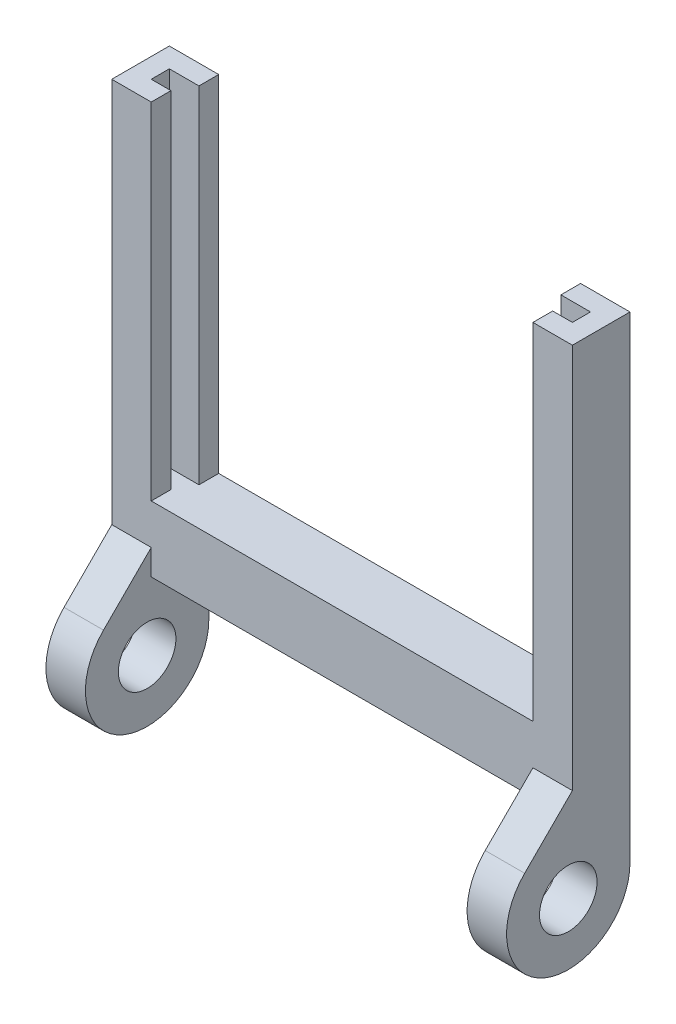
from build123d import *

# Parameters (mm, degrees)
SCHIZZO1_W                   = 28
SCHIZZO1_H                   = 25
ESTRUSIONE_ESTRUSIONE1_DEPTH = 1.2
SCHIZZO4_W                   = 22
SCHIZZO4_H                   = 21
TAGLIO_ESTRUSIONE1_DEPTH     = 19.806647761
SCHIZZO2_R                   = 1.75
ESTRUSIONE_ESTRUSIONE2_DEPTH = 2.4
ESTRUSIONE_ESTRUSIONE3_DEPTH = 23.146699141
SCHIZZO5_W                   = 28
SCHIZZO5_H                   = 4
ESTRUSIONE_ESTRUSIONE4_DEPTH = 2.3


with BuildPart() as part:
    # Schizzo1 → Estrusione-Estrusione1 (new body)
    with BuildSketch(Plane.XY):
        Rectangle(SCHIZZO1_W, SCHIZZO1_H)
    extrude(amount=ESTRUSIONE_ESTRUSIONE1_DEPTH)

    # Schizzo4 → Taglio-Estrusione1 (cut, through all)
    with BuildSketch(Plane.XY.offset(1.2)):
        with Locations((0, 2)):
            Rectangle(SCHIZZO4_W, SCHIZZO4_H)
    extrude(amount=-TAGLIO_ESTRUSIONE1_DEPTH, mode=Mode.SUBTRACT)

    # Schizzo2 → Estrusione-Estrusione2 (add)
    with BuildSketch(Plane(origin=(14, 0, 0), x_dir=(0, 0, -1), z_dir=(1, 0, 0))):
        with BuildLine():
            Line((0, -12.5), (0, -16.5))
            ThreePointArc((0, -16.5), (-5.185062871, -19.964548247), (-6.401650429, -13.848349571))
            Line((-6.401650429, -13.848349571), (-3.2, -10.646699141))
            Line((-3.2, -10.646699141), (-1.2, -10.646699141))
            Line((-1.2, -10.646699141), (-1.2, -12.5))
            Line((-1.2, -12.5), (0, -12.5))
        make_face()
        with Locations((-3.75, -16.5)):
            Circle(SCHIZZO2_R, mode=Mode.SUBTRACT)
    estrusione_estrusione2 = extrude(amount=-ESTRUSIONE_ESTRUSIONE2_DEPTH)

    # Schizzo3 → Estrusione-Estrusione3 (add)
    with BuildSketch(Plane(origin=(0, 12.5, 0), x_dir=(1, 0, 0), z_dir=(0, 1, 0))):
        Polygon((14, -1.2), (14, -3.5), (11.6, -3.5), (11.6, -2.3), (12.8, -2.3), (12.8, -1.2), align=None)
    estrusione_estrusione3 = extrude(amount=-ESTRUSIONE_ESTRUSIONE3_DEPTH)

    # Specchia1: Estrusione-Estrusione2, Estrusione-Estrusione3 across plane
    add(estrusione_estrusione2.mirror(Plane(origin=(0, 0, 0), x_dir=(0, 0, 1), z_dir=(1, 0, 0))))
    add(estrusione_estrusione3.mirror(Plane(origin=(0, 0, 0), x_dir=(0, 0, 1), z_dir=(1, 0, 0))))

    # Schizzo5 → Estrusione-Estrusione4 (add)
    with BuildSketch(Plane.XY.offset(1.2)):
        with Locations((0, -10.5)):
            Rectangle(SCHIZZO5_W, SCHIZZO5_H)
    extrude(amount=ESTRUSIONE_ESTRUSIONE4_DEPTH)


solid = part.part
